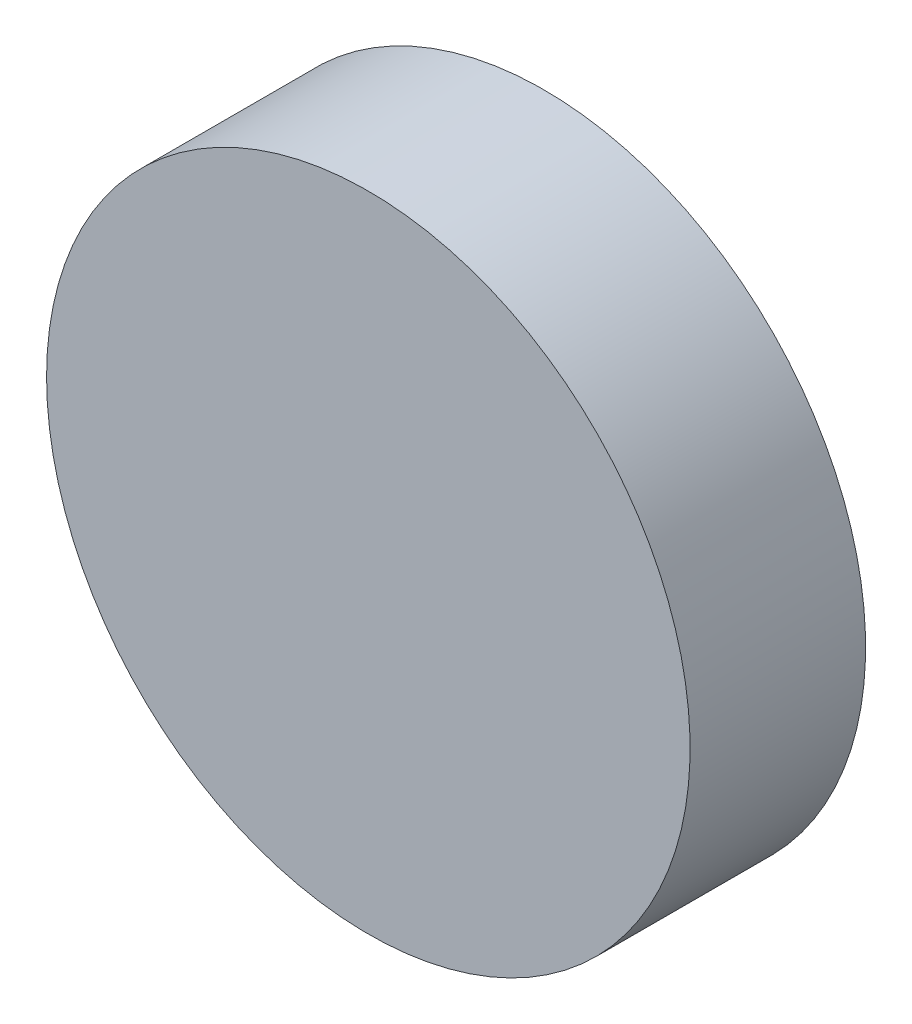
from build123d import *

# Parameters (mm, degrees)
SKETCH1_R           = 8.73125
BOSS_EXTRUDE1_DEPTH = 4.7625


with BuildPart() as part:
    # Sketch1 → Boss-Extrude1 (new body)
    with BuildSketch(Plane.XY):
        with Locations(Location((0, 0, 0), (0, 0, 180))):
            Circle(SKETCH1_R)
    extrude(amount=BOSS_EXTRUDE1_DEPTH)


solid = part.part
